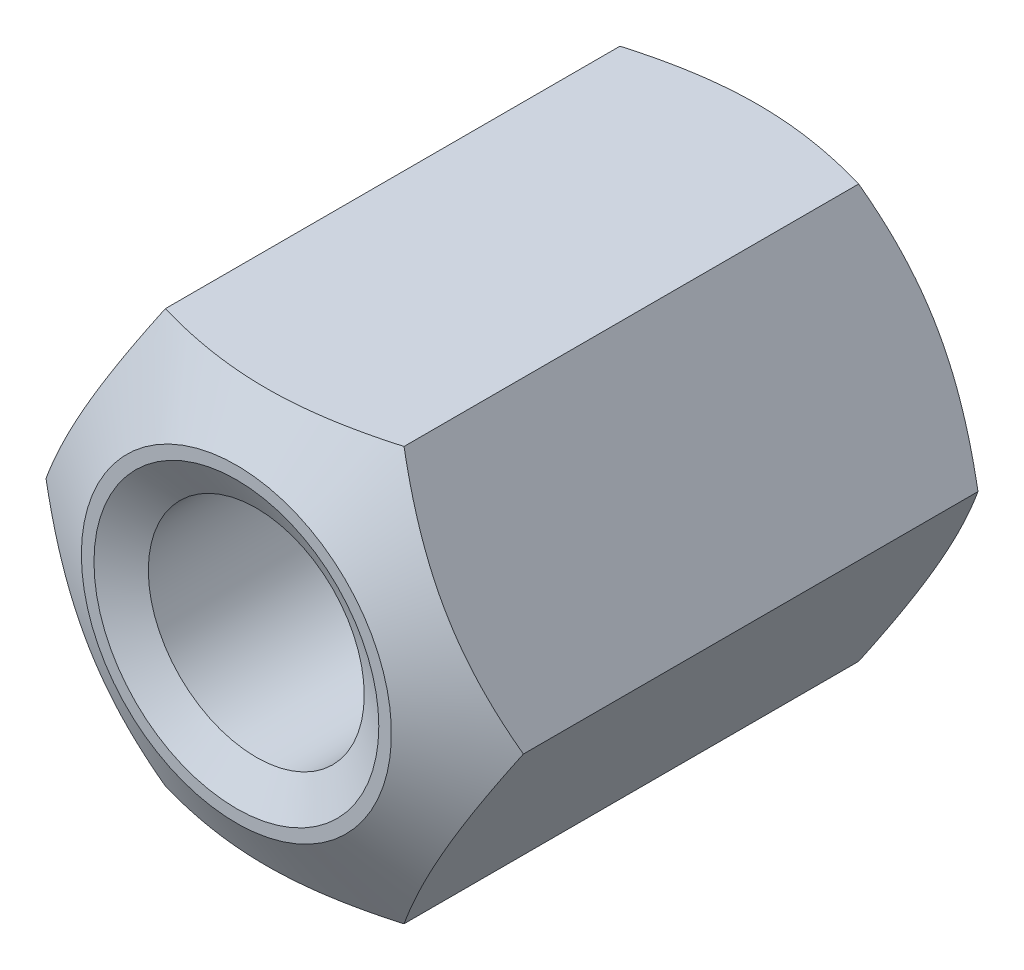
from build123d import *
from OCP.BRepFilletAPI import BRepFilletAPI_MakeChamfer

# Parameters (mm, degrees)
SKETCH1_R        = 0.7835
BASENUT_DEPTH    = 4
ENDCHAMFER_SIZE  = 0.25
ENDCHAMFER_SIZE2 = 0.144337567


with BuildPart() as part:
    # Sketch1 → BaseNut (new body)
    with BuildSketch(Plane.XY):
        Polygon((0.866025404, -1.5), (1.732050808, 0), (0.866025404, 1.5), (-0.866025404, 1.5), (-1.732050808, 0), (-0.866025404, -1.5), align=None)
        Circle(SKETCH1_R, mode=Mode.SUBTRACT)
    extrude(amount=-BASENUT_DEPTH)

    # Sketch2 → Double-Chamfer (revolve, cut)
    with BuildSketch(Plane(origin=(0, 0, 0), x_dir=(1, 0, 0), z_dir=(0, 1, 0))):
        Polygon((-1.732050808, 4), (-1.125, 4), (-1.732050808, 3.649519053), align=None)
        Polygon((-1.732050808, 0.350480947), (-1.732050808, 0), (-1.125, 0), align=None)
    revolve(axis=Axis((0, 0, -9.817107763), (0, 0, 1)), mode=Mode.SUBTRACT)

    # EndChamfer: one chamfer whose edges measure the first distance from different faces: ONE call of the kernel's chamfer builder (chamfer() names one face for all edges)
    endchamfer_edges_1 = [part.edges().sort_by_distance(p)[0] for p in [
        (-0.7835, 0, -4),
    ]]
    endchamfer_side_1 = [part.faces().sort_by_distance(p)[0] for p in [
        (-0.7835, 0, -2),
    ]]
    endchamfer_edges_2 = [part.edges().sort_by_distance(p)[0] for p in [
        (-0.7835, 0, 0),
    ]]
    endchamfer_side_2 = [part.faces().sort_by_distance(p)[0] for p in [
        (1.093180195, 0, 0),
    ]]
    endchamfer = BRepFilletAPI_MakeChamfer(part.part.solid().wrapped)
    for e in endchamfer_edges_1:
        endchamfer.Add(ENDCHAMFER_SIZE, ENDCHAMFER_SIZE2, e.wrapped, endchamfer_side_1[0].wrapped)  # the first distance lies on this face
    for e in endchamfer_edges_2:
        endchamfer.Add(ENDCHAMFER_SIZE, ENDCHAMFER_SIZE2, e.wrapped, endchamfer_side_2[0].wrapped)  # the first distance lies on this face
    add(Compound.cast(endchamfer.Shape()), mode=Mode.REPLACE)


solid = part.part
